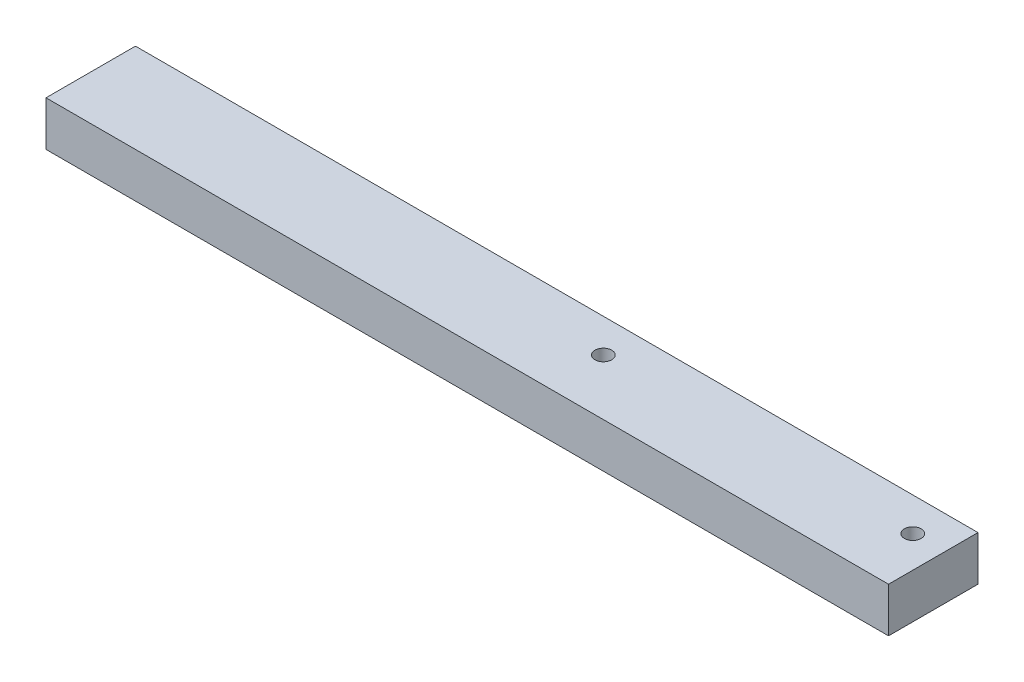
from build123d import *

# Parameters (mm, degrees)
ESQUISSE1_W             = 452
ESQUISSE1_H             = 48
BOSS_EXTRU_1_DEPTH      = 24
ESQUISSE2_R             = 4.5
ENL_V_MAT_EXTRU_1_DEPTH = 229.534461296


with BuildPart() as part:
    # Esquisse1 → Boss.-Extru.1 (new body)
    with BuildSketch(Plane(origin=(0, 0, 0), x_dir=(1, 0, 0), z_dir=(0, 1, 0))):
        Rectangle(ESQUISSE1_W, ESQUISSE1_H)
    extrude(amount=BOSS_EXTRU_1_DEPTH)

    # Esquisse2 → Enlèv. mat.-Extru.1 (cut, through all)
    with BuildSketch(Plane(origin=(0, 0, 0), x_dir=(-1, 0, 0), z_dir=(0, -1, 0))):
        with Locations(Location((-209, 6, 0), (0, 0, 90))):
            Circle(ESQUISSE2_R)
        with Locations(Location((-43, 6, 0), (0, 0, 90))):
            Circle(ESQUISSE2_R)
    extrude(amount=-ENL_V_MAT_EXTRU_1_DEPTH, mode=Mode.SUBTRACT)


solid = part.part
